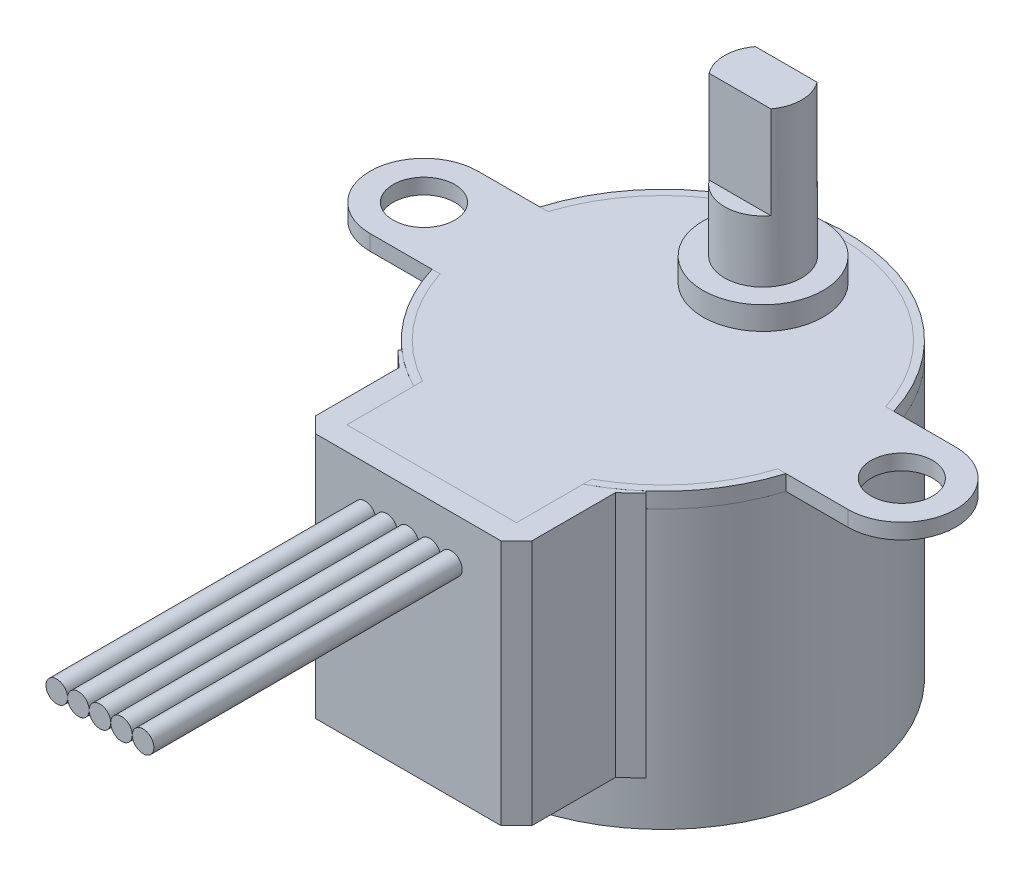
from build123d import *
from build123d.topology import SkipClean

# Parameters (mm, degrees)
SKETCH1_R             = 12
BOSS_EXTRUDE1_DEPTH   = 18
SKETCH2_R             = 2
BOSS_EXTRUDE2_DEPTH   = 1
BOSS_EXTRUDE3_DEPTH   = 1
BOSS_EXTRUDE3_2_DEPTH = 1
BOSS_EXTRUDE3_3_DEPTH = 1
BOSS_EXTRUDE4_DEPTH   = 16
BOSS_EXTRUDE5_DEPTH   = 1
SKETCH6_R             = 3.9
BOSS_EXTRUDE6_DEPTH   = 1.5
SKETCH7_R             = 2.5
BOSS_EXTRUDE7_DEPTH   = 4
BOSS_EXTRUDE8_DEPTH   = 6
SKETCH9_R             = 0.7
BOSS_EXTRUDE9_DEPTH   = 20
LPATTERN1_COUNT       = 5
LPATTERN1_PITCH       = 1.4


with BuildPart() as part:
    # Sketch1 → Boss-Extrude1 (new body)
    with BuildSketch(Plane(origin=(0, 0, 0), x_dir=(1, 0, 0), z_dir=(0, 1, 0))):
        with Locations(Location((0, 0, 0), (0, 0, 270))):
            Circle(SKETCH1_R)
    extrude(amount=BOSS_EXTRUDE1_DEPTH)



with BuildPart() as body_2:
    # Sketch2 → Boss-Extrude2 (new body)
    with BuildSketch(Plane(origin=(0, 18, 0), x_dir=(1, 0, 0), z_dir=(0, 1, 0))):
        with BuildLine():
            Line((10.95445115, 3.5), (15.5, 3.5))
            ThreePointArc((15.5, 3.5), (19, 0), (15.5, -3.5))
            Line((15.5, -3.5), (10.95445115, -3.5))
            ThreePointArc((10.95445115, -3.5), (8.864288297, -7.326280979), (5.5, -10.099504938))
            Line((5.5, -10.099504938), (5.5, -15))
            Line((5.5, -15), (-5.5, -15))
            Line((-5.5, -15), (-5.5, -10.099504938))
            ThreePointArc((-5.5, -10.099504938), (-8.864288297, -7.326280979), (-10.95445115, -3.5))
            Line((-10.95445115, -3.5), (-15.5, -3.5))
            ThreePointArc((-15.5, -3.5), (-19, 0), (-15.5, 3.5))
            Line((-15.5, 3.5), (-10.95445115, 3.5))
            ThreePointArc((-10.95445115, 3.5), (0, 11.5), (10.95445115, 3.5))
        make_face()
        with Locations(Location((15.5, 0, 0), (0, 0, 270))):
            Circle(SKETCH2_R, mode=Mode.SUBTRACT)
        with Locations(Location((-15.5, 0, 0), (0, 0, 90))):
            Circle(SKETCH2_R, mode=Mode.SUBTRACT)
    extrude(amount=BOSS_EXTRUDE2_DEPTH)


with BuildPart() as body_3:
    # Sketch3 → Boss-Extrude3 (new body)
    with BuildSketch(Plane(origin=(0, 18, 0), x_dir=(1, 0, 0), z_dir=(0, 1, 0))):
        with BuildLine():
            Line((-11.478240283, 3.5), (-10.95445115, 3.5))
            ThreePointArc((-10.95445115, 3.5), (0, 11.5), (10.95445115, 3.5))
            Line((10.95445115, 3.5), (11.478240283, 3.5))
            ThreePointArc((11.478240283, 3.5), (0, 12), (-11.478240283, 3.5))
        make_face()
    extrude(amount=BOSS_EXTRUDE3_DEPTH)


with BuildPart() as body_4:
    # Sketch3 → Boss-Extrude3 2 (new body)
    with BuildSketch(Plane(origin=(0, 18, 0), x_dir=(1, 0, 0), z_dir=(0, 1, 0))):
        with BuildLine():
            Line((11.478240283, -3.5), (10.95445115, -3.5))
            ThreePointArc((10.95445115, -3.5), (8.864288297, -7.326280979), (5.5, -10.099504938))
            Line((5.5, -10.099504938), (5.5, -10.665364504))
            ThreePointArc((5.5, -10.665364504), (9.214161541, -7.687602169), (11.478240283, -3.5))
        make_face()
    extrude(amount=BOSS_EXTRUDE3_2_DEPTH)


with BuildPart() as body_5:
    # Sketch3 → Boss-Extrude3 3 (new body)
    with BuildSketch(Plane(origin=(0, 18, 0), x_dir=(1, 0, 0), z_dir=(0, 1, 0))):
        with BuildLine():
            Line((-10.95445115, -3.5), (-11.478240283, -3.5))
            ThreePointArc((-11.478240283, -3.5), (-9.214161541, -7.687602169), (-5.5, -10.665364504))
            Line((-5.5, -10.665364504), (-5.5, -10.099504938))
            ThreePointArc((-5.5, -10.099504938), (-8.864288297, -7.326280979), (-10.95445115, -3.5))
        make_face()
    extrude(amount=BOSS_EXTRUDE3_3_DEPTH)


with BuildPart() as body_6:
    # Sketch4 → Boss-Extrude4 (new body)
    with BuildSketch(Plane(origin=(0, 19, 0), x_dir=(1, 0, 0), z_dir=(0, 1, 0))):
        with BuildLine():
            Line((5.5, -15), (5.5, -10.665364504))
            ThreePointArc((5.5, -10.665364504), (6.763786043, -9.91217425), (7.925906242, -9.009995019))
            Line((7.925906242, -9.009995019), (8.044708004, -9.145046235))
            Line((8.044708004, -9.145046235), (7.02, -10.099504938))
            Line((7.02, -10.099504938), (7.02, -15.52))
            Line((7.02, -15.52), (6.02, -16.52))
            Line((6.02, -16.52), (-6.02, -16.52))
            Line((-6.02, -16.52), (-7.02, -15.52))
            Line((-7.02, -15.52), (-7.02, -10.099504938))
            Line((-7.02, -10.099504938), (-8.044708004, -9.145046235))
            Line((-8.044708004, -9.145046235), (-7.925906242, -9.009995019))
            ThreePointArc((-7.925906242, -9.009995019), (-6.763786043, -9.91217425), (-5.5, -10.665364504))
            Line((-5.5, -10.665364504), (-5.5, -15))
            Line((-5.5, -15), (5.5, -15))
        make_face()
    extrude(amount=-BOSS_EXTRUDE4_DEPTH)


with BuildPart() as part_1:
    add(part.part)

    add(body_6.part)  # Boss-Extrude5 merges body 6
    # Sketch5 → Boss-Extrude5 (add)
    with BuildSketch(Plane.XZ.offset(-3)):
        with BuildLine():
            Line((-5.5, 15), (-5.5, 10.665364504))
            ThreePointArc((-5.5, 10.665364504), (0, 12), (5.5, 10.665364504))
            Line((5.5, 10.665364504), (5.5, 15))
            Line((5.5, 15), (-5.5, 15))
        make_face()
        with BuildLine():
            Line((-8.044708004, 9.145046235), (-7.925906242, 9.009995019))
            ThreePointArc((-7.925906242, 9.009995019), (-6.763786043, 9.91217425), (-5.5, 10.665364504))
            Line((-5.5, 10.665364504), (-5.5, 15))
            Line((-5.5, 15), (5.5, 15))
            Line((5.5, 15), (5.5, 10.665364504))
            ThreePointArc((5.5, 10.665364504), (6.763786043, 9.91217425), (7.925906242, 9.009995019))
            Line((7.925906242, 9.009995019), (8.044708004, 9.145046235))
            Line((8.044708004, 9.145046235), (7.02, 10.099504938))
            Line((7.02, 10.099504938), (7.02, 15.52))
            Line((7.02, 15.52), (6.02, 16.52))
            Line((6.02, 16.52), (-6.02, 16.52))
            Line((-6.02, 16.52), (-7.02, 15.52))
            Line((-7.02, 15.52), (-7.02, 10.099504938))
            Line((-7.02, 10.099504938), (-8.044708004, 9.145046235))
        make_face()
    extrude(amount=-BOSS_EXTRUDE5_DEPTH)


with BuildPart() as body_6_2:
    # Sketch6 → Boss-Extrude6 (new body)
    with BuildSketch(Plane(origin=(0, 19, 0), x_dir=(1, 0, 0), z_dir=(0, 1, 0))):
        with Locations(Location((0, 6.5, 0), (0, 0, 270))):
            Circle(SKETCH6_R)
    extrude(amount=BOSS_EXTRUDE6_DEPTH)


with BuildPart() as body_7:
    # Sketch7 → Boss-Extrude7 (new body)
    with BuildSketch(Plane(origin=(0, 20.5, 0), x_dir=(1, 0, 0), z_dir=(0, 1, 0))):
        with Locations(Location((0, 6.5, 0), (0, 0, 270))):
            Circle(SKETCH7_R)
    extrude(amount=BOSS_EXTRUDE7_DEPTH)

    # Sketch8 → Boss-Extrude8 (add)
    with SkipClean():  # the faces are left unmerged after this step: merging them gives an invalid solid
        with BuildSketch(Plane(origin=(0, 24.5, 0), x_dir=(1, 0, 0), z_dir=(0, 1, 0))):
            with BuildLine():
                Line((-2, 8), (2, 8))
                ThreePointArc((2, 8), (2.5, 6.5), (2, 5))
                Line((2, 5), (-2, 5))
                ThreePointArc((-2, 5), (-2.5, 6.5), (-2, 8))
            make_face()
        extrude(amount=BOSS_EXTRUDE8_DEPTH)


with BuildPart() as body_8:
    # Sketch9 → Boss-Extrude9 (new body)
    with BuildSketch(Plane.XY.offset(16.52)):
        with Locations((-2.8, 16.128230697)):
            Circle(SKETCH9_R)
    extrude(amount=BOSS_EXTRUDE9_DEPTH)


with BuildPart() as lpattern1_1:
    # LPattern1: pattern copy
    add(body_8.part.moved(Location(Vector(1, 0, 0) * (1 * LPATTERN1_PITCH))))


with BuildPart() as lpattern1_2:
    # LPattern1: pattern copy
    add(body_8.part.moved(Location(Vector(1, 0, 0) * (2 * LPATTERN1_PITCH))))


with BuildPart() as lpattern1_3:
    # LPattern1: pattern copy
    add(body_8.part.moved(Location(Vector(1, 0, 0) * (3 * LPATTERN1_PITCH))))


with BuildPart() as lpattern1_4:
    # LPattern1: pattern copy
    add(body_8.part.moved(Location(Vector(1, 0, 0) * (4 * LPATTERN1_PITCH))))


solid = Compound([body_2.part, body_3.part, body_4.part, body_5.part, part_1.part, body_6_2.part, body_7.part, body_8.part, lpattern1_1.part, lpattern1_2.part, lpattern1_3.part, lpattern1_4.part])
